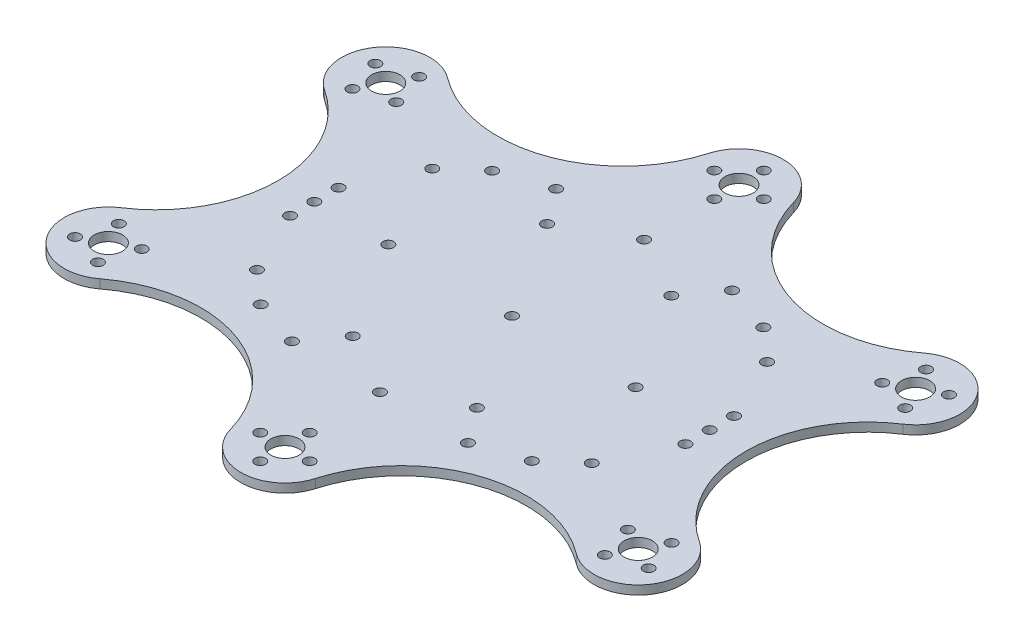
from build123d import *

# Parameters (mm, degrees)
SKETCH1_R           = 4
SKETCH1_R_2         = 1.5
BOSS_EXTRUDE1_DEPTH = 2.5


with BuildPart() as part:
    # Sketch1 → Boss-Extrude1 (new body)
    with BuildSketch(Plane(origin=(0, 0, 0), x_dir=(1, 0, 0), z_dir=(0, 1, 0))):
        with BuildLine():
            ThreePointArc((12.022120265, 67.673247628), (0, 76.75), (-12.022120265, 67.673247628))
            ThreePointArc((-12.022120265, 67.673247628), (-34.842613641, 43.81538777), (-67.414732932, 49.203285306))
            ThreePointArc((-67.414732932, 49.203285306), (-85.189938198, 46.45680917), (-81.819417269, 28.789306741))
            ThreePointArc((-81.819417269, 28.789306741), (-66.25, 0), (-81.819417269, -28.789306741))
            ThreePointArc((-81.819417269, -28.789306741), (-85.189938198, -46.45680917), (-67.414732932, -49.203285306))
            ThreePointArc((-67.414732932, -49.203285306), (-34.842613641, -43.81538777), (-12.022120265, -67.673247628))
            ThreePointArc((-12.022120265, -67.673247628), (0, -76.75), (12.022120265, -67.673247628))
            ThreePointArc((12.022120265, -67.673247628), (34.842613641, -43.81538777), (67.414732932, -49.203285306))
            ThreePointArc((67.414732932, -49.203285306), (85.189938198, -46.45680917), (81.819417269, -28.789306741))
            ThreePointArc((81.819417269, -28.789306741), (66.25, 0), (81.819417269, 28.789306741))
            ThreePointArc((81.819417269, 28.789306741), (85.189938198, 46.45680917), (67.414732932, 49.203285306))
            ThreePointArc((67.414732932, 49.203285306), (34.842613641, 43.81538777), (12.022120265, 67.673247628))
        make_face()
        with Locations(Location((0, 64.25, 0), (0, 0, 270))):
            Circle(SKETCH1_R, mode=Mode.SUBTRACT)
        with Locations(Location((-7, 64.25, 0), (0, 0, 270))):
            Circle(SKETCH1_R_2, mode=Mode.SUBTRACT)
        with Locations(Location((0, 57.25, 0), (0, 0, 270))):
            Circle(SKETCH1_R_2, mode=Mode.SUBTRACT)
        with Locations(Location((7, 64.25, 0), (0, 0, 270))):
            Circle(SKETCH1_R_2, mode=Mode.SUBTRACT)
        with Locations(Location((0, 71.25, 0), (0, 0, 270))):
            Circle(SKETCH1_R_2, mode=Mode.SUBTRACT)
        with Locations(Location((0, 37.375, 0), (0, 0, 270))):
            Circle(SKETCH1_R_2, mode=Mode.SUBTRACT)
        with Locations(Location((17.575, 27.5, 0), (0, 0, 270))):
            Circle(SKETCH1_R_2, mode=Mode.SUBTRACT)
        with Locations(Location((24.9, 37.375, 0), (0, 0, 270))):
            Circle(SKETCH1_R_2, mode=Mode.SUBTRACT)
        with Locations(Location((38.375, 32.75, 0), (0, 0, 270))):
            Circle(SKETCH1_R_2, mode=Mode.SUBTRACT)
        with Locations(Location((47.375, 24.800648389, 0), (0, 0, 270))):
            Circle(SKETCH1_R_2, mode=Mode.SUBTRACT)
        with Locations(Location((74.976618386, 39.25, 0), (0, 0, 270))):
            Circle(SKETCH1_R, mode=Mode.SUBTRACT)
        with Locations(Location((68.775, 36.003474258, 0), (0, 0, 270))):
            Circle(SKETCH1_R_2, mode=Mode.SUBTRACT)
        with Locations(Location((71.730092644, 45.451618386, 0), (0, 0, 270))):
            Circle(SKETCH1_R_2, mode=Mode.SUBTRACT)
        with Locations(Location((81.178236772, 42.496525742, 0), (0, 0, 270))):
            Circle(SKETCH1_R_2, mode=Mode.SUBTRACT)
        with Locations(Location((78.223144128, 33.048381614, 0), (0, 0, 270))):
            Circle(SKETCH1_R_2, mode=Mode.SUBTRACT)
        with Locations(Location((35, 0, 0), (0, 0, 270))):
            Circle(SKETCH1_R_2, mode=Mode.SUBTRACT)
        with Locations(Location((-35, 0, 0), (0, 0, 270))):
            Circle(SKETCH1_R_2, mode=Mode.SUBTRACT)
        with Locations(Location((-47.375, 24.800648389, 0), (0, 0, 270))):
            Circle(SKETCH1_R_2, mode=Mode.SUBTRACT)
        with Locations(Location((-38.375, 32.75, 0), (0, 0, 270))):
            Circle(SKETCH1_R_2, mode=Mode.SUBTRACT)
        with Locations(Location((-17.575, 27.5, 0), (0, 0, 270))):
            Circle(SKETCH1_R_2, mode=Mode.SUBTRACT)
        with Locations(Location((-24.9, 37.375, 0), (0, 0, 270))):
            Circle(SKETCH1_R_2, mode=Mode.SUBTRACT)
        with Locations(Location((-78.223144128, 33.048381614, 0), (0, 0, 270))):
            Circle(SKETCH1_R_2, mode=Mode.SUBTRACT)
        with Locations(Location((-81.178236772, 42.496525742, 0), (0, 0, 270))):
            Circle(SKETCH1_R_2, mode=Mode.SUBTRACT)
        with Locations(Location((-71.730092644, 45.451618386, 0), (0, 0, 270))):
            Circle(SKETCH1_R_2, mode=Mode.SUBTRACT)
        with Locations(Location((-68.775, 36.003474258, 0), (0, 0, 270))):
            Circle(SKETCH1_R_2, mode=Mode.SUBTRACT)
        with Locations(Location((-74.976618386, 39.25, 0), (0, 0, 270))):
            Circle(SKETCH1_R, mode=Mode.SUBTRACT)
        with Locations(Location((-24.9, -37.375, 0), (0, 0, 270))):
            Circle(SKETCH1_R_2, mode=Mode.SUBTRACT)
        with Locations(Location((-17.575, -27.5, 0), (0, 0, 270))):
            Circle(SKETCH1_R_2, mode=Mode.SUBTRACT)
        with Locations(Location((-38.375, -32.75, 0), (0, 0, 270))):
            Circle(SKETCH1_R_2, mode=Mode.SUBTRACT)
        with Locations(Location((-47.375, -24.800648389, 0), (0, 0, 270))):
            Circle(SKETCH1_R_2, mode=Mode.SUBTRACT)
        with Locations(Location((47.375, -24.800648389, 0), (0, 0, 270))):
            Circle(SKETCH1_R_2, mode=Mode.SUBTRACT)
        with Locations(Location((38.375, -32.75, 0), (0, 0, 270))):
            Circle(SKETCH1_R_2, mode=Mode.SUBTRACT)
        with Locations(Location((24.9, -37.375, 0), (0, 0, 270))):
            Circle(SKETCH1_R_2, mode=Mode.SUBTRACT)
        with Locations(Location((17.575, -27.5, 0), (0, 0, 270))):
            Circle(SKETCH1_R_2, mode=Mode.SUBTRACT)
        with Locations(Location((0, -37.375, 0), (0, 0, 270))):
            Circle(SKETCH1_R_2, mode=Mode.SUBTRACT)
        with Locations(Location((0, -71.25, 0), (0, 0, 270))):
            Circle(SKETCH1_R_2, mode=Mode.SUBTRACT)
        with Locations(Location((7, -64.25, 0), (0, 0, 270))):
            Circle(SKETCH1_R_2, mode=Mode.SUBTRACT)
        with Locations(Location((0, -57.25, 0), (0, 0, 270))):
            Circle(SKETCH1_R_2, mode=Mode.SUBTRACT)
        with Locations(Location((-7, -64.25, 0), (0, 0, 270))):
            Circle(SKETCH1_R_2, mode=Mode.SUBTRACT)
        with Locations(Location((0, -64.25, 0), (0, 0, 270))):
            Circle(SKETCH1_R, mode=Mode.SUBTRACT)
        with Locations(Location((78.223144128, -33.048381614, 0), (0, 0, 270))):
            Circle(SKETCH1_R_2, mode=Mode.SUBTRACT)
        with Locations(Location((81.178236772, -42.496525742, 0), (0, 0, 270))):
            Circle(SKETCH1_R_2, mode=Mode.SUBTRACT)
        with Locations(Location((71.730092644, -45.451618386, 0), (0, 0, 270))):
            Circle(SKETCH1_R_2, mode=Mode.SUBTRACT)
        with Locations(Location((68.775, -36.003474258, 0), (0, 0, 270))):
            Circle(SKETCH1_R_2, mode=Mode.SUBTRACT)
        with Locations(Location((74.976618386, -39.25, 0), (0, 0, 270))):
            Circle(SKETCH1_R, mode=Mode.SUBTRACT)
        with Locations(Location((-74.976618386, -39.25, 0), (0, 0, 270))):
            Circle(SKETCH1_R, mode=Mode.SUBTRACT)
        with Locations(Location((-68.775, -36.003474258, 0), (0, 0, 270))):
            Circle(SKETCH1_R_2, mode=Mode.SUBTRACT)
        with Locations(Location((-71.730092644, -45.451618386, 0), (0, 0, 270))):
            Circle(SKETCH1_R_2, mode=Mode.SUBTRACT)
        with Locations(Location((-81.178236772, -42.496525742, 0), (0, 0, 270))):
            Circle(SKETCH1_R_2, mode=Mode.SUBTRACT)
        with Locations(Location((-78.223144128, -33.048381614, 0), (0, 0, 270))):
            Circle(SKETCH1_R_2, mode=Mode.SUBTRACT)
        with Locations(Location((-55.95, 0, 0), (0, 0, 270))):
            Circle(SKETCH1_R_2, mode=Mode.SUBTRACT)
        with Locations(Location((-55.95, 6.875, 0), (0, 0, 270))):
            Circle(SKETCH1_R_2, mode=Mode.SUBTRACT)
        with Locations(Location((-55.95, -6.875, 0), (0, 0, 270))):
            Circle(SKETCH1_R_2, mode=Mode.SUBTRACT)
        with Locations(Location((55.95, 6.875, 0), (0, 0, 270))):
            Circle(SKETCH1_R_2, mode=Mode.SUBTRACT)
        with Locations(Location((55.95, 0, 0), (0, 0, 270))):
            Circle(SKETCH1_R_2, mode=Mode.SUBTRACT)
        with Locations(Location((55.95, -6.875, 0), (0, 0, 270))):
            Circle(SKETCH1_R_2, mode=Mode.SUBTRACT)
        with Locations(Location((0, 0, 0), (0, 0, 270))):
            Circle(SKETCH1_R_2, mode=Mode.SUBTRACT)
    extrude(amount=BOSS_EXTRUDE1_DEPTH)


solid = part.part
